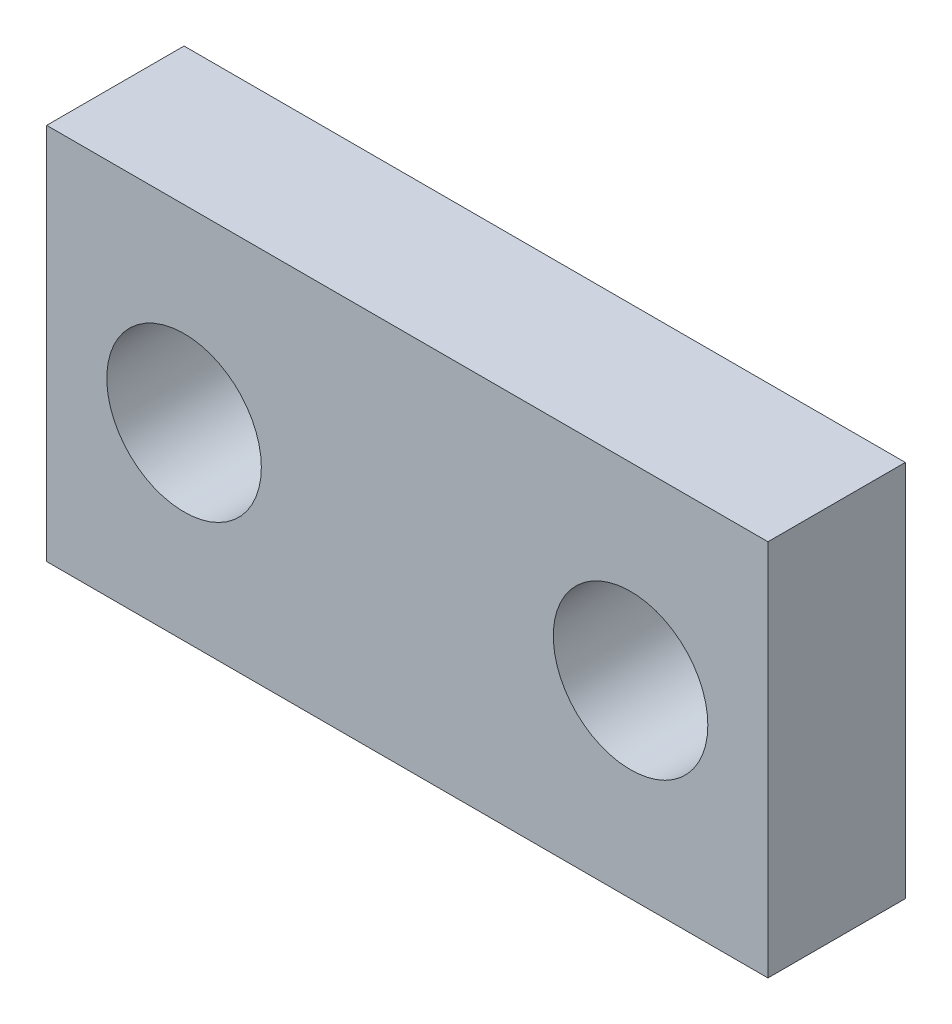
from build123d import *

# Parameters (mm, degrees)
SKETCH1_W           = 21
SKETCH1_H           = 11
SKETCH1_R           = 2.25
BOSS_EXTRUDE1_DEPTH = 4


with BuildPart() as part:
    # Sketch1 → Boss-Extrude1 (new body)
    with BuildSketch(Plane.XY):
        Rectangle(SKETCH1_W, SKETCH1_H)
        with Locations((-6.5, 0)):
            Circle(SKETCH1_R, mode=Mode.SUBTRACT)
        with Locations((6.5, 0)):
            Circle(SKETCH1_R, mode=Mode.SUBTRACT)
    extrude(amount=BOSS_EXTRUDE1_DEPTH)


solid = part.part
